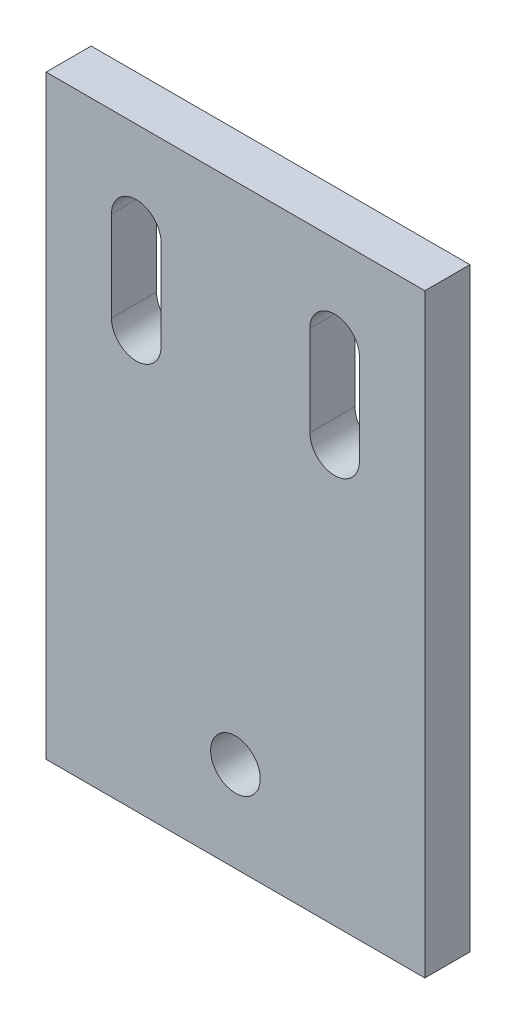
from build123d import *

# Parameters (mm, degrees)
SKETCH1_W           = 42
SKETCH1_H           = 66
BOSS_EXTRUDE1_DEPTH = 5
D_GAGEMENT_M51_D    = 5.5
CUT_EXTRUDE1_DEPTH  = 40.433488306


with BuildPart() as part:
    # Sketch1 → Boss-Extrude1 (new body)
    with BuildSketch(Plane.XY):
        Rectangle(SKETCH1_W, SKETCH1_H)
    extrude(amount=BOSS_EXTRUDE1_DEPTH)

    # Dégagement M51 (through all)
    with Locations(Plane.XY.offset(5)):
        with Locations((11, 18), (-11, 18), (0, -23)):
            Hole(D_GAGEMENT_M51_D / 2)

    # Sketch5 → Cut-Extrude1 (cut, through all)
    with BuildSketch(Plane.XY.offset(5)):
        with BuildLine():
            Line((-13.75, 13), (-13.75, 23))
            ThreePointArc((-13.75, 23), (-11, 25.75), (-8.25, 23))
            Line((-8.25, 23), (-8.25, 13))
            ThreePointArc((-8.25, 13), (-11, 10.25), (-13.75, 13))
        make_face()
        with BuildLine():
            Line((8.25, 13), (8.25, 23))
            ThreePointArc((8.25, 23), (11, 25.75), (13.75, 23))
            Line((13.75, 23), (13.75, 13))
            ThreePointArc((13.75, 13), (11, 10.25), (8.25, 13))
        make_face()
    extrude(amount=-CUT_EXTRUDE1_DEPTH, mode=Mode.SUBTRACT)


solid = part.part
